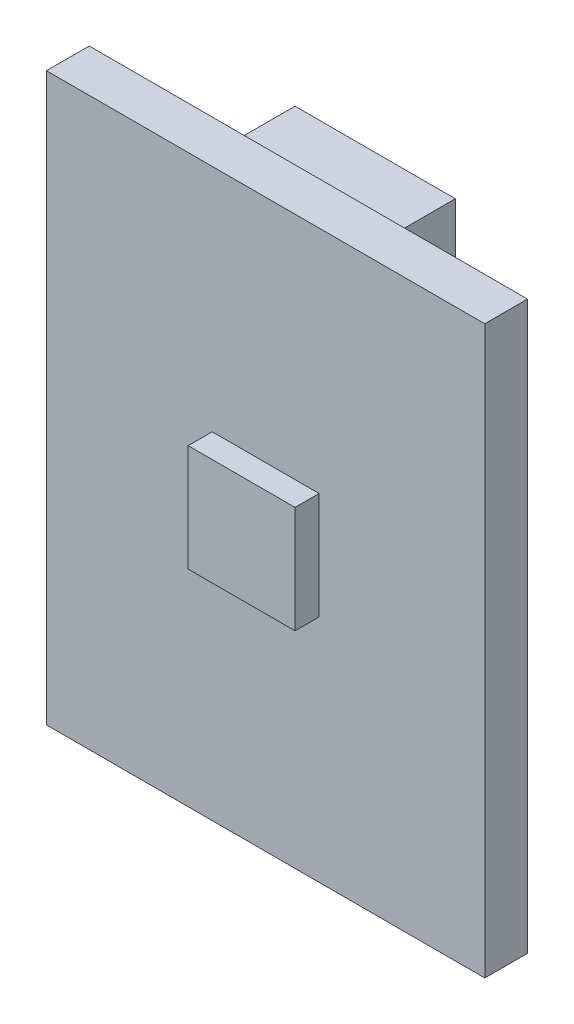
from build123d import *

# Parameters (mm, degrees)
SKETCH1_W           = 16.4
SKETCH1_H           = 21.2
BOSS_EXTRUDE1_DEPTH = 1.6
SKETCH2_W           = 6
SKETCH2_H           = 20
BOSS_EXTRUDE2_DEPTH = 2.5
SKETCH3_W           = 4
SKETCH3_H           = 4
BOSS_EXTRUDE3_DEPTH = 0.9


with BuildPart() as part:
    # Sketch1 → Boss-Extrude1 (new body)
    with BuildSketch(Plane.XY.offset(13.1)):
        with Locations((22, 3)):
            Rectangle(SKETCH1_W, SKETCH1_H)
    extrude(amount=BOSS_EXTRUDE1_DEPTH)

    # Sketch2 → Boss-Extrude2 (add)
    with BuildSketch(Plane.XY.offset(10.6)):
        with Locations((22, 3)):
            Rectangle(SKETCH2_W, SKETCH2_H)
    extrude(amount=BOSS_EXTRUDE2_DEPTH)

    # Sketch3 → Boss-Extrude3 (add)
    with BuildSketch(Plane.XY.offset(14.7)):
        with Locations((22, 3)):
            Rectangle(SKETCH3_W, SKETCH3_H)
    extrude(amount=BOSS_EXTRUDE3_DEPTH)


solid = part.part
